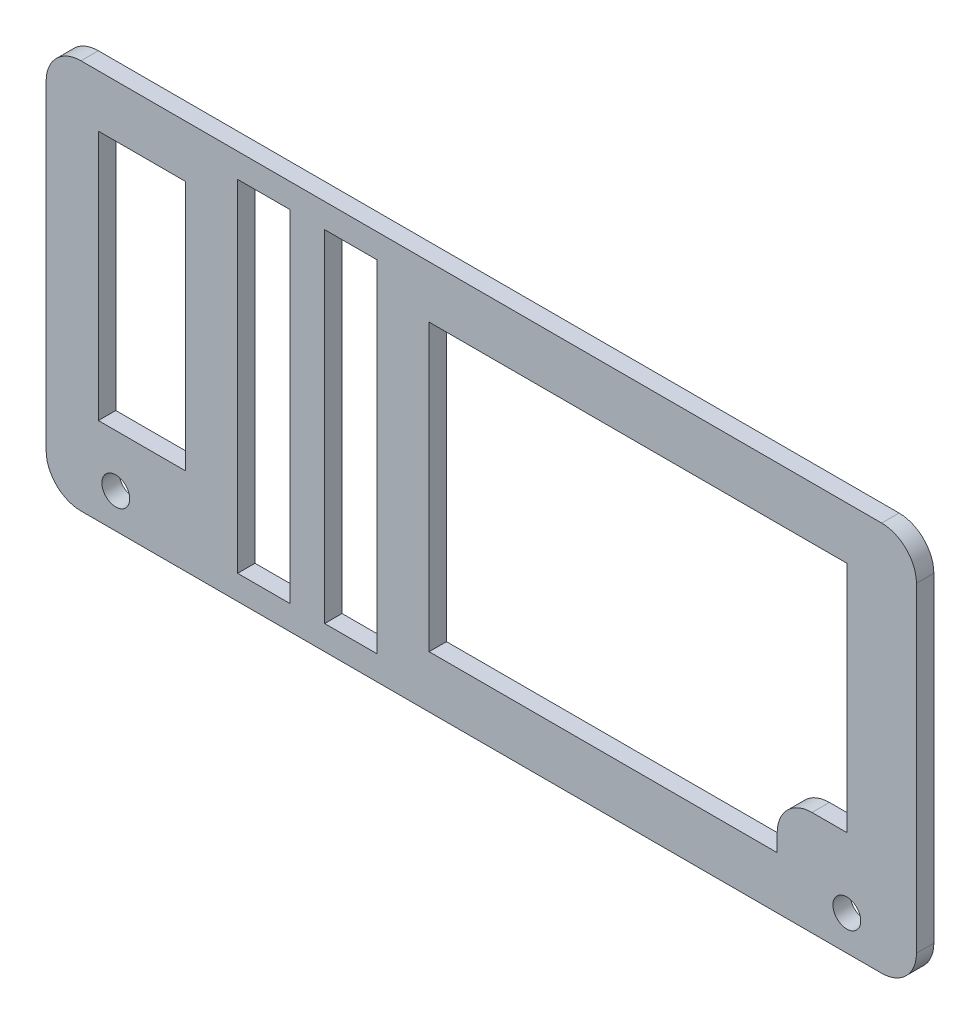
from build123d import *

# Parameters (mm, degrees)
SKETCH1_W           = 250
SKETCH1_H           = 112
BOSS_EXTRUDE1_DEPTH = 5
SKETCH2_R           = 4
CUT_EXTRUDE1_DEPTH  = 11
SKETCH3_R           = 4
CUT_EXTRUDE2_DEPTH  = 15
SKETCH4_W           = 15
SKETCH4_H           = 98
CUT_EXTRUDE4_DEPTH  = 15
CUT_EXTRUDE5_DEPTH  = 15
FILLET1_R           = 10
SKETCH6_W           = 25
SKETCH6_H           = 72
CUT_EXTRUDE6_DEPTH  = 5


with BuildPart() as part:
    # Sketch1 → Boss-Extrude1 (new body)
    with BuildSketch(Plane.XY):
        with Locations((-57.664233577, 31.912408759)):
            Rectangle(SKETCH1_W, SKETCH1_H)
    extrude(amount=BOSS_EXTRUDE1_DEPTH)

    # Sketch2 → Cut-Extrude1 (cut)
    with BuildSketch(Plane.XY.offset(5)):
        with Locations((-162.664233577, -14.087591241)):
            Circle(SKETCH2_R)
    extrude(amount=-CUT_EXTRUDE1_DEPTH, mode=Mode.SUBTRACT)

    # Sketch3 → Cut-Extrude2 (cut)
    with BuildSketch(Plane.XY.offset(5)):
        with Locations((47.335766423, -14.087591241)):
            Circle(SKETCH3_R)
    extrude(amount=-CUT_EXTRUDE2_DEPTH, mode=Mode.SUBTRACT)

    # Sketch4 → Cut-Extrude4 (cut)
    with BuildSketch(Plane.XY.offset(5)):
        with Locations((-120.164233577, 31.912408759)):
            Rectangle(SKETCH4_W, SKETCH4_H)
        with Locations((-95.164233577, 31.912408759)):
            Rectangle(SKETCH4_W, SKETCH4_H)
    extrude(amount=-CUT_EXTRUDE4_DEPTH, mode=Mode.SUBTRACT)

    # Sketch5 → Cut-Extrude5 (cut)
    with BuildSketch(Plane.XY.offset(5)):
        Polygon((17.397729683, 72.912408759), (-72.664233577, 72.912408759), (-72.664233577, -9.087591241), (27.335766423, -9.087591241), (27.335766423, 5.912408759), (47.335766423, 5.912408759), (47.335766423, 72.912408759), align=None)
    extrude(amount=-CUT_EXTRUDE5_DEPTH, mode=Mode.SUBTRACT)

    # Fillet1
    fillet1_edges = [part.edges().sort_by_distance(p)[0] for p in [
        (27.335766423, 5.912408759, 2.5),
        (-182.664233577, 87.912408759, 2.5),
        (67.335766423, 87.912408759, 2.5),
        (67.335766423, -24.087591241, 2.5),
        (-182.664233577, -24.087591241, 2.5),
    ]]
    fillet(fillet1_edges, radius=FILLET1_R)

    # Sketch6 → Cut-Extrude6 (cut)
    with BuildSketch(Plane.XY.offset(5)):
        with Locations((-155.164233577, 36.912408759)):
            Rectangle(SKETCH6_W, SKETCH6_H)
    extrude(amount=-CUT_EXTRUDE6_DEPTH, mode=Mode.SUBTRACT)


solid = part.part
